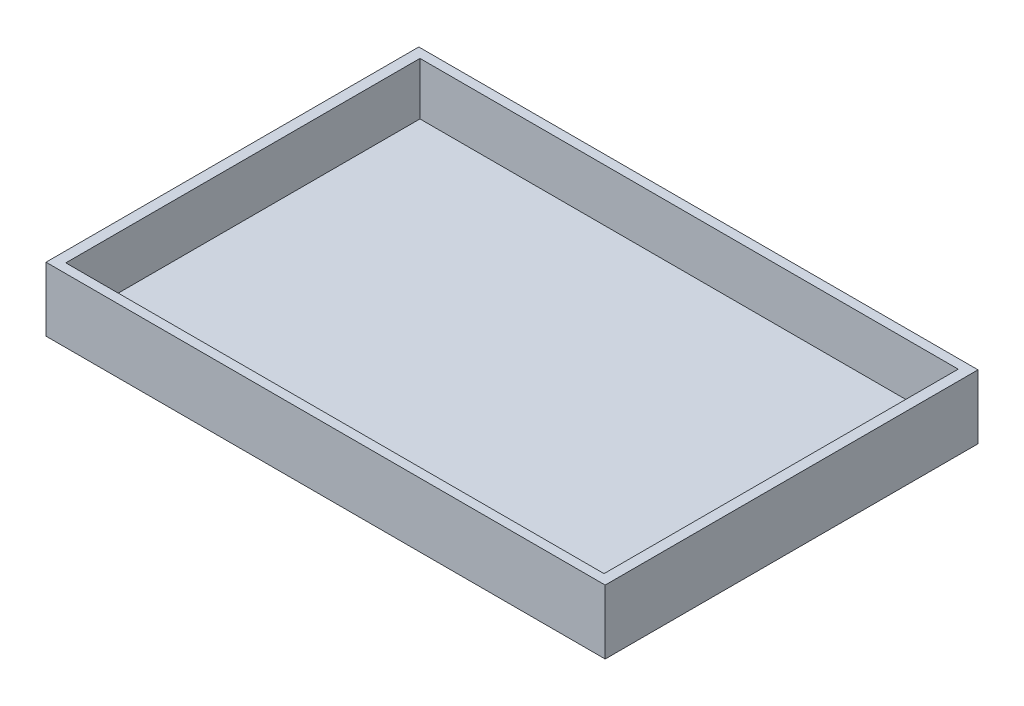
from build123d import *

# Parameters (mm, degrees)
ESQUISSE1_W             = 48
ESQUISSE1_H             = 32
BOSS_EXTRU_1_DEPTH      = 5.5
ESQUISSE2_W             = 46.2
ESQUISSE2_H             = 30.4
ENL_V_MAT_EXTRU_1_DEPTH = 4.5


with BuildPart() as part:
    # Esquisse1 → Boss.-Extru.1 (new body)
    with BuildSketch(Plane(origin=(0, 0, 0), x_dir=(1, 0, 0), z_dir=(0, 1, 0))):
        Rectangle(ESQUISSE1_W, ESQUISSE1_H)
    extrude(amount=BOSS_EXTRU_1_DEPTH)

    # Esquisse2 → Enlèv. mat.-Extru.1 (cut)
    with BuildSketch(Plane(origin=(0, 5.5, 0), x_dir=(1, 0, 0), z_dir=(0, 1, 0))):
        Rectangle(ESQUISSE2_W, ESQUISSE2_H)
    extrude(amount=-ENL_V_MAT_EXTRU_1_DEPTH, mode=Mode.SUBTRACT)


solid = part.part
